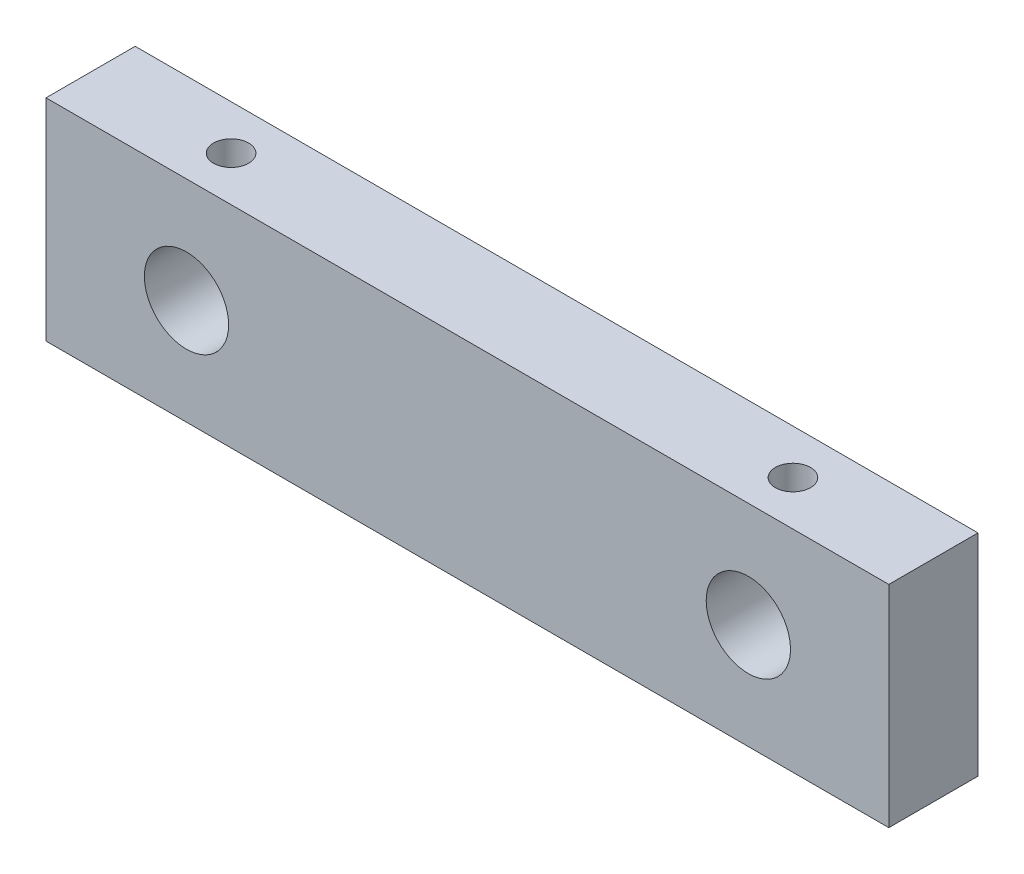
from build123d import *

# Parameters (mm, degrees)
SKETCH1_W             = 60
SKETCH1_H             = 15
SKETCH1_R             = 3
BOSS_EXTRUDE1_DEPTH   = 6.35
M3_TAPPED_HOLE1_D     = 2.5
M3_TAPPED_HOLE1_DEPTH = 8.5
M3_TAPPED_HOLE1_TIP   = 0.751075774


with BuildPart() as part:
    # Sketch1 → Boss-Extrude1 (new body)
    with BuildSketch(Plane.XY):
        with Locations((30, 7.5)):
            Rectangle(SKETCH1_W, SKETCH1_H)
        with Locations((10, 7.5)):
            Circle(SKETCH1_R, mode=Mode.SUBTRACT)
        with Locations((50, 7.5)):
            Circle(SKETCH1_R, mode=Mode.SUBTRACT)
    extrude(amount=BOSS_EXTRUDE1_DEPTH)

    # M3 Tapped Hole1
    with Locations(Plane(origin=(0, 15, 0), x_dir=(-1, 0, 0), z_dir=(0, 1, 0))):
        with Locations((-10, 3.175), (-50, 3.175)):
            Hole(M3_TAPPED_HOLE1_D / 2, depth=M3_TAPPED_HOLE1_DEPTH)
            with Locations((0, 0, -(M3_TAPPED_HOLE1_DEPTH + M3_TAPPED_HOLE1_TIP / 2))):  # 118° drill point
                Cone(0, M3_TAPPED_HOLE1_D / 2, M3_TAPPED_HOLE1_TIP, mode=Mode.SUBTRACT)


solid = part.part
